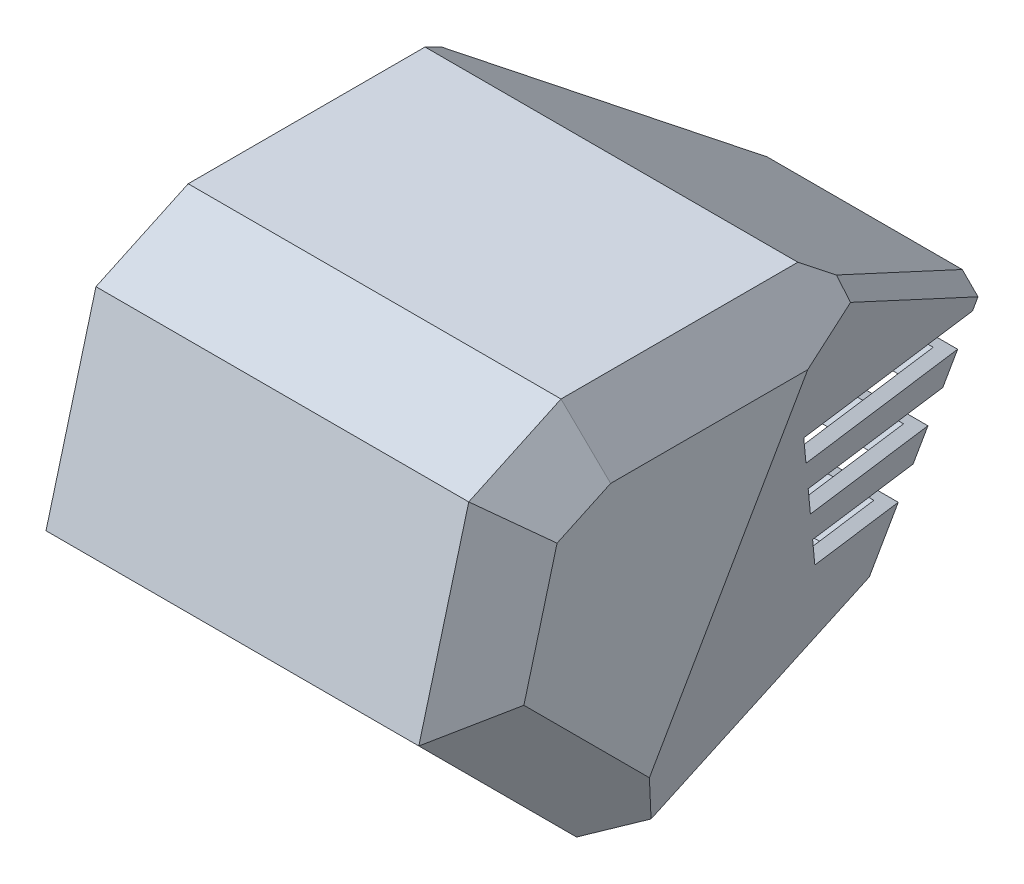
from build123d import *
from OCP.BRepFilletAPI import BRepFilletAPI_MakeChamfer

# Parameters (mm, degrees)
BOSS_EXTRU_1_DEPTH      = 310
CHANFREIN1_SIZE         = 80
CHANFREIN1_SIZE2        = 219.798193556
CHANFREIN2_SIZE         = 25
CHANFREIN2_SIZE2        = 43.301270189
CHANFREIN3_SIZE         = 10
CHANFREIN3_SIZE2        = 11.000628676
CHANFREIN3_SIZE2_2      = 10.311972297
COQUE1_T                = 10
ENL_V_MAT_EXTRU_1_DEPTH = 657.524942405


with BuildPart() as part:
    # Esquisse1 → Boss.-Extru.1 (new body)
    with BuildSketch(Plane(origin=(0, 0, 0), x_dir=(0, 0, -1), z_dir=(1, 0, 0))):
        Polygon((369.170962313, 100), (450, 240), (264.340759124, 370), (99.168602631, 370), (34.833395016, 340), (0, 210), (110, 100), align=None)
    extrude(amount=BOSS_EXTRU_1_DEPTH)

    # Chanfrein1
    chanfrein1_edges = [part.edges().sort_by_distance(p)[0] for p in [
        (310, 170, -409.585481157),
        (0, 170, -409.585481157),
    ]]
    chanfrein1_side = [part.faces().sort_by_distance(p)[0] for p in [
        (155, 170, -409.585481157),
    ]]
    chamfer(chanfrein1_edges, length=CHANFREIN1_SIZE, length2=CHANFREIN1_SIZE2, reference=chanfrein1_side[0])

    # Chanfrein2: one chamfer whose edges measure the first distance from different faces: ONE call of the kernel's chamfer builder (chamfer() names one face for all edges)
    chanfrein2_edges_1 = [part.edges().sort_by_distance(p)[0] for p in [
        (0, 155, -55),
        (310, 155, -55),
    ]]
    chanfrein2_side_1 = [part.faces().sort_by_distance(p)[0] for p in [
        (155, 155, -55),
    ]]
    chanfrein2_edges_2 = [part.edges().sort_by_distance(p)[0] for p in [
        (0, 275, -17.416697508),
        (310, 275, -17.416697508),
    ]]
    chanfrein2_side_2 = [part.faces().sort_by_distance(p)[0] for p in [
        (155, 275, -17.416697508),
    ]]
    chanfrein2_edges_3 = [part.edges().sort_by_distance(p)[0] for p in [
        (0, 355, -67.000998824),
        (310, 355, -67.000998824),
    ]]
    chanfrein2_side_3 = [part.faces().sort_by_distance(p)[0] for p in [
        (155, 355, -67.000998824),
    ]]
    chanfrein2_edges_4 = [part.edges().sort_by_distance(p)[0] for p in [
        (0, 370, -181.754680877),
        (310, 370, -181.754680877),
    ]]
    chanfrein2_side_4 = [part.faces().sort_by_distance(p)[0] for p in [
        (155, 370, -181.754680877),
    ]]
    chanfrein2 = BRepFilletAPI_MakeChamfer(part.part.solid().wrapped)
    for e in chanfrein2_edges_1:
        chanfrein2.Add(CHANFREIN2_SIZE, CHANFREIN2_SIZE2, e.wrapped, chanfrein2_side_1[0].wrapped)  # the first distance lies on this face
    for e in chanfrein2_edges_2:
        chanfrein2.Add(CHANFREIN2_SIZE, CHANFREIN2_SIZE2, e.wrapped, chanfrein2_side_2[0].wrapped)  # the first distance lies on this face
    for e in chanfrein2_edges_3:
        chanfrein2.Add(CHANFREIN2_SIZE, CHANFREIN2_SIZE2, e.wrapped, chanfrein2_side_3[0].wrapped)  # the first distance lies on this face
    for e in chanfrein2_edges_4:
        chanfrein2.Add(CHANFREIN2_SIZE, CHANFREIN2_SIZE2, e.wrapped, chanfrein2_side_4[0].wrapped)  # the first distance lies on this face
    add(Compound.cast(chanfrein2.Shape()), mode=Mode.REPLACE)

    # Chanfrein3: one chamfer whose edges measure the first distance from different faces: ONE call of the kernel's chamfer builder (chamfer() names one face for all edges)
    chanfrein3_edges_1 = [part.edges().sort_by_distance(p)[0] for p in [
        (155, 240, -450),
    ]]
    chanfrein3_side_1 = [part.faces().sort_by_distance(p)[0] for p in [
        (155, 170, -409.585481157),
    ]]
    chanfrein3_edges_2 = [part.edges().sort_by_distance(p)[0] for p in [
        (46.013035878, 293.764248554, -373.216695593),
    ]]
    chanfrein3_side_2 = [part.faces().sort_by_distance(p)[0] for p in [
        (36.692430522, 203.807514508, -291.710403206),
    ]]
    chanfrein3_edges_3 = [part.edges().sort_by_distance(p)[0] for p in [
        (263.986964122, 293.764248554, -373.216695593),
    ]]
    chanfrein3_side_3 = [part.faces().sort_by_distance(p)[0] for p in [
        (273.307569478, 203.807514508, -291.710403206),
    ]]
    chanfrein3 = BRepFilletAPI_MakeChamfer(part.part.solid().wrapped)
    for e in chanfrein3_edges_1:
        chanfrein3.Add(CHANFREIN3_SIZE, CHANFREIN3_SIZE2, e.wrapped, chanfrein3_side_1[0].wrapped)  # the first distance lies on this face
    for e in chanfrein3_edges_2:
        chanfrein3.Add(CHANFREIN3_SIZE, CHANFREIN3_SIZE2_2, e.wrapped, chanfrein3_side_2[0].wrapped)  # the first distance lies on this face
    for e in chanfrein3_edges_3:
        chanfrein3.Add(CHANFREIN3_SIZE, CHANFREIN3_SIZE2_2, e.wrapped, chanfrein3_side_3[0].wrapped)  # the first distance lies on this face
    add(Compound.cast(chanfrein3.Shape()), mode=Mode.REPLACE)

    # Coque1 (no face opened: a closed hollow body)
    add(offset(amount=-COQUE1_T, mode=Mode.PRIVATE), mode=Mode.SUBTRACT)

    # Esquisse2 → Enlèv. mat.-Extru.1 (cut, through all)
    with BuildSketch(Plane(origin=(0, 0, 0), x_dir=(0, 0, -1), z_dir=(1, 0, 0))):
        Polygon((441.142030756, 224.657547217), (256.142030756, 274.228147817), (264.492620752, 251.285090363), (430.789268951, 206.726037773), align=None)
        Polygon((297.894980737, 159.512860546), (389.378221735, 135), (399.730983539, 152.931509443), (289.544390741, 182.455918), align=None)
        Polygon((272.843210748, 228.342032908), (281.193800745, 205.398975454), (410.083745343, 170.863018887), (420.436507147, 188.79452833), align=None)
    extrude(amount=ENL_V_MAT_EXTRU_1_DEPTH, mode=Mode.SUBTRACT)


solid = part.part
